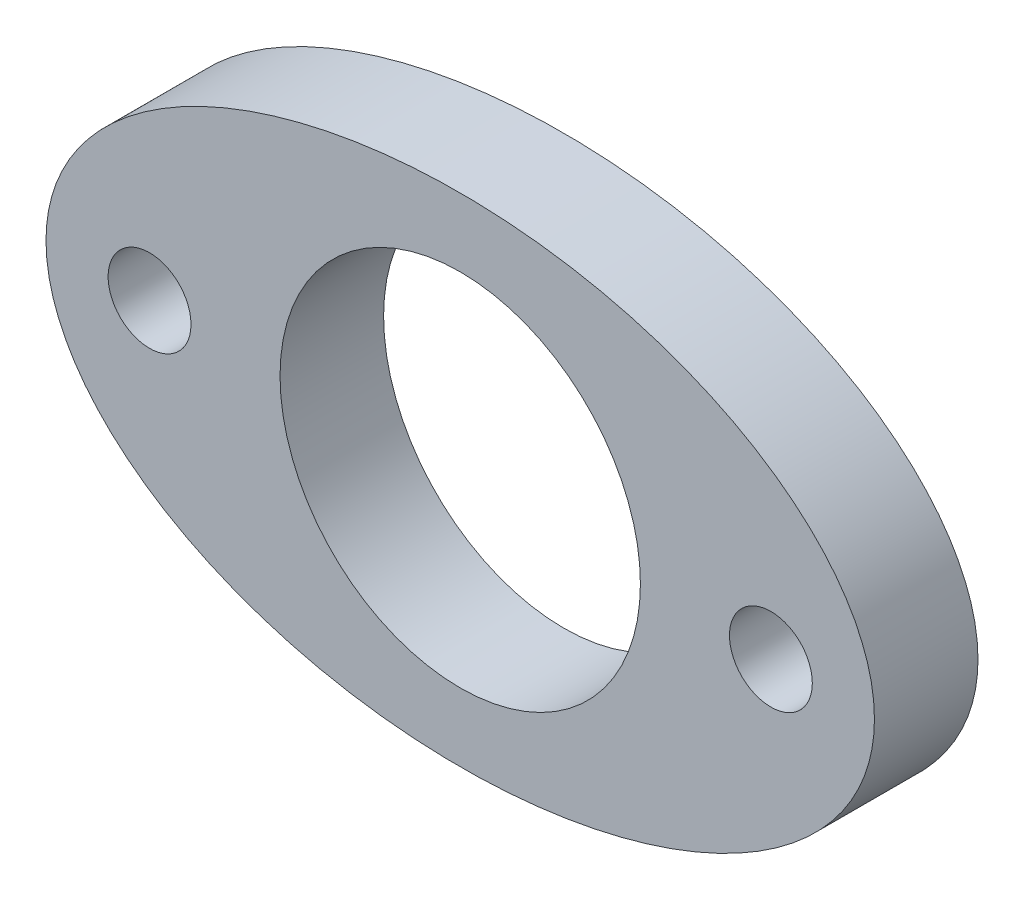
from build123d import *

# Parameters (mm, degrees)
SKETCH1_RX          = 25.4
SKETCH1_RY          = 15.24
SKETCH1_R           = 11.049
SKETCH1_R_2         = 2.54
BOSS_EXTRUDE1_DEPTH = 6.35


with BuildPart() as part:
    # Sketch1 → Boss-Extrude1 (new body)
    with BuildSketch(Plane.XY):
        with Locations((0, 0)):
            Ellipse(SKETCH1_RX, SKETCH1_RY)
        Circle(SKETCH1_R, mode=Mode.SUBTRACT)
        with Locations((-19.05, 0)):
            Circle(SKETCH1_R_2, mode=Mode.SUBTRACT)
        with Locations((19.05, 0)):
            Circle(SKETCH1_R_2, mode=Mode.SUBTRACT)
    extrude(amount=BOSS_EXTRUDE1_DEPTH)


solid = part.part
